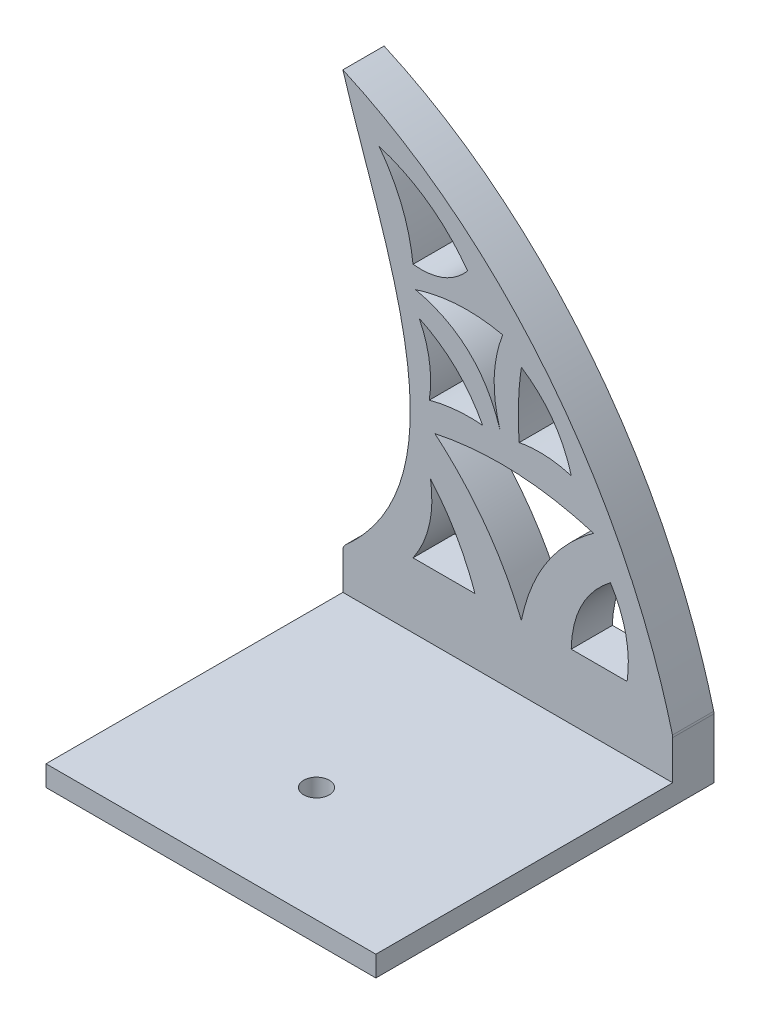
from build123d import *

# Parameters (mm, degrees)
SKETCH1_W           = 101.6
SKETCH1_H           = 152.4
BOSS_EXTRUDE1_DEPTH = 12.7
BOSS_EXTRUDE3_DEPTH = 12.7
FILLET1_R           = 2.54
FILLET2_R           = 5.08
CUT_EXTRUDE2_DEPTH  = 298.570512784
SKETCH8_W           = 101.6
SKETCH8_H           = 6.35
BOSS_EXTRUDE4_DEPTH = 91.44
SKETCH9_R           = 3.937
CUT_EXTRUDE3_DEPTH  = 202.484932954


with BuildPart() as part:
    # Sketch1 → Boss-Extrude1 (new body)
    with BuildSketch(Plane.XY):
        with Locations((50.8, 76.2)):
            Rectangle(SKETCH1_W, SKETCH1_H)
    extrude(amount=BOSS_EXTRUDE1_DEPTH)

    # Sketch2 → Boss-Extrude3 (add)
    with BuildSketch(Plane.XY):
        with BuildLine():
            add(Edge.make_bspline(
                [(0, 152.4), (39.790111277, 186.839065643), (12.30975625, 238.845497073), (0, 279.4)],
                knots=[0, 0, 0, 0, 1, 1, 1, 1], degree=3))
            add(Edge.make_bspline(
                [(0, 279.4), (51.286050257, 256.550041835), (87.836892382, 205.957944637), (101.6, 152.4)],
                knots=[0, 0, 0, 0, 1, 1, 1, 1], degree=3))
            Line((101.6, 152.4), (0, 152.4))
        make_face()
        with BuildLine():
            add(Edge.make_bspline(
                [(49.225838487, 233.315766274), (35.641228944, 236.267866949), (22.375615267, 231.937259722)],
                knots=[0, 0, 0, 1, 1, 1], degree=2))
            add(Edge.make_bspline(
                [(48.400350721, 207.535437601), (42.054170901, 227.566198031), (22.375615267, 231.937259722)],
                knots=[0, 0, 0, 1, 1, 1], degree=2))
            add(Edge.make_bspline(
                [(48.400350721, 207.535437601), (44.393568943, 220.734513873), (49.225838487, 233.315766274)],
                knots=[0, 0, 0, 1, 1, 1], degree=2))
        make_face(mode=Mode.SUBTRACT)
        with BuildLine():
            add(Edge.make_bspline(
                [(43.05348098, 206.08803494), (36.239789994, 218.91266054), (23.516066372, 224.861937296)],
                knots=[0, 0, 0, 1, 1, 1], degree=2))
            add(Edge.make_bspline(
                [(23.516066372, 224.861937296), (28.235295407, 215.21927262), (26.605728117, 204.582177714)],
                knots=[0, 0, 0, 1, 1, 1], degree=2))
            add(Edge.make_bspline(
                [(26.605728117, 204.582177714), (34.700432609, 206.792891754), (43.05348098, 206.08803494)],
                knots=[0, 0, 0, 1, 1, 1], degree=2))
        make_face(mode=Mode.SUBTRACT)
        with BuildLine():
            add(Edge.make_bspline(
                [(82.396089655, 183.81371778), (70.6713649, 174.663598784), (70.32777317, 160.02)],
                knots=[0, 0, 0, 1, 1, 1], degree=2))
            Line((70.32777317, 160.02), (87.546521436, 160.02))
            add(Edge.make_bspline(
                [(82.396089655, 183.81371778), (89.339550367, 172.773814043), (87.546521436, 160.02)],
                knots=[0, 0, 0, 1, 1, 1], degree=2))
        make_face(mode=Mode.SUBTRACT)
        with BuildLine():
            add(Edge.make_bspline(
                [(26.980466376, 183.81374211), (28.958775605, 170.837543608), (21.602944743, 160.02)],
                knots=[0, 0, 0, 1, 1, 1], degree=2))
            Line((21.602944743, 160.02), (40.676641776, 160.02))
            add(Edge.make_bspline(
                [(26.980466376, 183.81374211), (36.13847285, 173.175056715), (40.676641776, 160.02)],
                knots=[0, 0, 0, 1, 1, 1], degree=2))
        make_face(mode=Mode.SUBTRACT)
        with BuildLine():
            add(Edge.make_bspline(
                [(54.97708308, 160.02), (46.08347584, 181.54755316), (28.342136903, 196.529802482)],
                knots=[0, 0, 0, 1, 1, 1], degree=2))
            add(Edge.make_bspline(
                [(28.342136903, 196.529802482), (53.017815002, 201.732288521), (77.187204495, 194.363538628)],
                knots=[0, 0, 0, 1, 1, 1], degree=2))
            add(Edge.make_bspline(
                [(54.97708308, 160.02), (59.374728895, 181.400643158), (77.187204495, 194.363538628)],
                knots=[0, 0, 0, 1, 1, 1], degree=2))
        make_face(mode=Mode.SUBTRACT)
        with BuildLine():
            add(Edge.make_bspline(
                [(70.328259561, 206.277457578), (62.361576962, 208.669014941), (54.287141362, 207.109917469)],
                knots=[0, 0, 0, 1, 1, 1], degree=2))
            add(Edge.make_bspline(
                [(54.287141362, 207.109917469), (53.482096811, 217.391663167), (54.97708308, 227.557269012)],
                knots=[0, 0, 0, 1, 1, 1], degree=2))
            add(Edge.make_bspline(
                [(54.97708308, 227.557269012), (66.645859754, 219.852180834), (70.328259561, 206.277457578)],
                knots=[0, 0, 0, 1, 1, 1], degree=2))
        make_face(mode=Mode.SUBTRACT)
        with BuildLine():
            add(Edge.make_bspline(
                [(21.602944743, 238.323137826), (19.95197567, 252.974545225), (11.094737768, 264.601494061)],
                knots=[0, 0, 0, 1, 1, 1], degree=2))
            add(Edge.make_bspline(
                [(11.094737768, 264.601494061), (28.053835186, 259.295838115), (38.412267282, 244.949944056)],
                knots=[0, 0, 0, 1, 1, 1], degree=2))
            add(Edge.make_bspline(
                [(21.602944743, 238.323137826), (31.864782779, 237.284469605), (38.412267282, 244.949944056)],
                knots=[0, 0, 0, 1, 1, 1], degree=2))
        make_face(mode=Mode.SUBTRACT)
    extrude(amount=BOSS_EXTRUDE3_DEPTH)

    # Fillet1
    fillet1_edges = [part.edges().sort_by_distance(p)[0] for p in [
        (101.6, 152.4, 6.35),
        (0, 152.4, 6.35),
    ]]
    fillet(fillet1_edges, radius=FILLET1_R)

    # Fillet2
    fillet2_edges = [part.edges().sort_by_distance(p)[0] for p in [
        (0, 0, 6.35),
        (101.6, 0, 6.35),
    ]]
    fillet(fillet2_edges, radius=FILLET2_R)

    # Sketch5 → Cut-Extrude2 (cut, through all)
    with BuildSketch(Plane.XY.offset(12.7)):
        with BuildLine():
            Line((101.6, 133.663922723), (101.519048921, 133.663922723))
            Line((101.519048921, 133.663922723), (0, 133.663922723))
            Line((0, 133.663922723), (0, 5.08))
            ThreePointArc((0, 5.08), (1.487897552, 1.487897552), (5.08, 0))
            Line((5.08, 0), (96.52, 0))
            ThreePointArc((96.52, 0), (100.112102448, 1.487897552), (101.6, 5.08))
            Line((101.6, 5.08), (101.6, 133.663922723))
        make_face()
    extrude(amount=-CUT_EXTRUDE2_DEPTH, mode=Mode.SUBTRACT)

    # Sketch8 → Boss-Extrude4 (add)
    with BuildSketch(Plane.XY.offset(12.7)):
        with Locations((50.8, 136.838922723)):
            Rectangle(SKETCH8_W, SKETCH8_H)
    extrude(amount=BOSS_EXTRUDE4_DEPTH)

    # Sketch9 → Cut-Extrude3 (cut, through all)
    with BuildSketch(Plane(origin=(0, 140.013922723, 0), x_dir=(1, 0, 0), z_dir=(0, 1, 0))):
        with Locations(Location((48.006, -68.834, 0), (0, 0, 270))):
            Circle(SKETCH9_R)
    extrude(amount=-CUT_EXTRUDE3_DEPTH, mode=Mode.SUBTRACT)


solid = part.part
